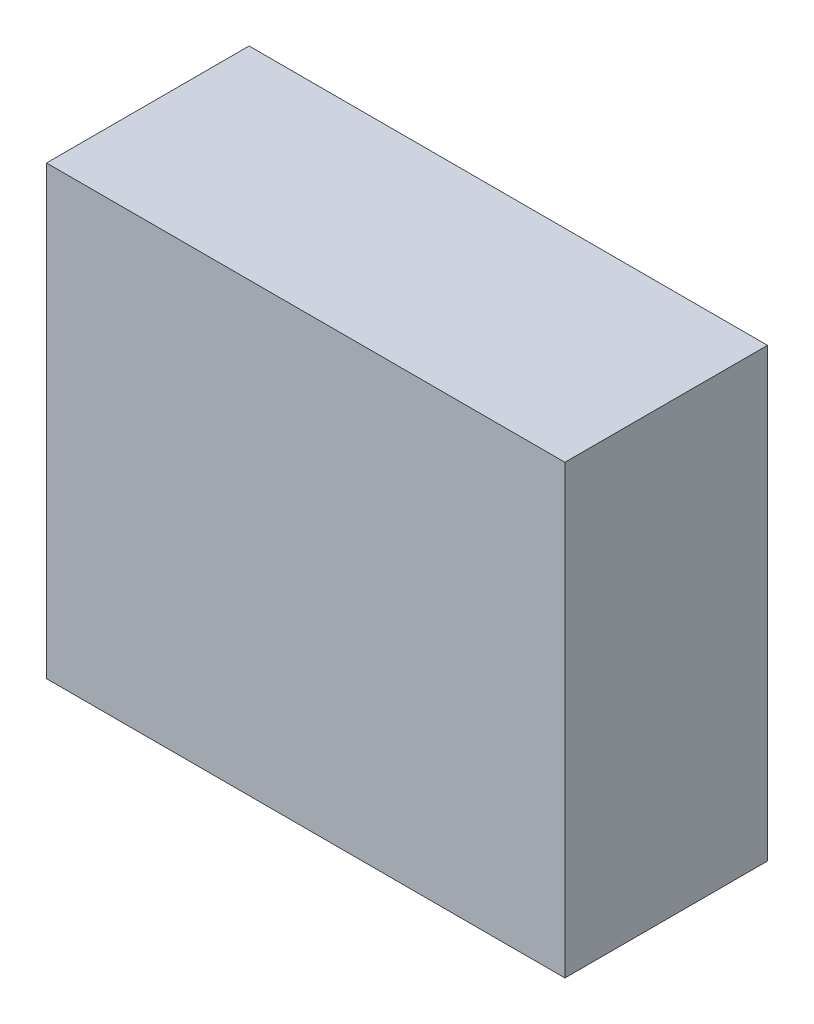
from build123d import *

# Parameters (mm, degrees)
SKETCH1_W           = 65
SKETCH1_H           = 56
BOSS_EXTRUDE1_DEPTH = 25.4


with BuildPart() as part:
    # Sketch1 → Boss-Extrude1 (new body)
    with BuildSketch(Plane.XY):
        Rectangle(SKETCH1_W, SKETCH1_H)
    extrude(amount=BOSS_EXTRUDE1_DEPTH)


solid = part.part
